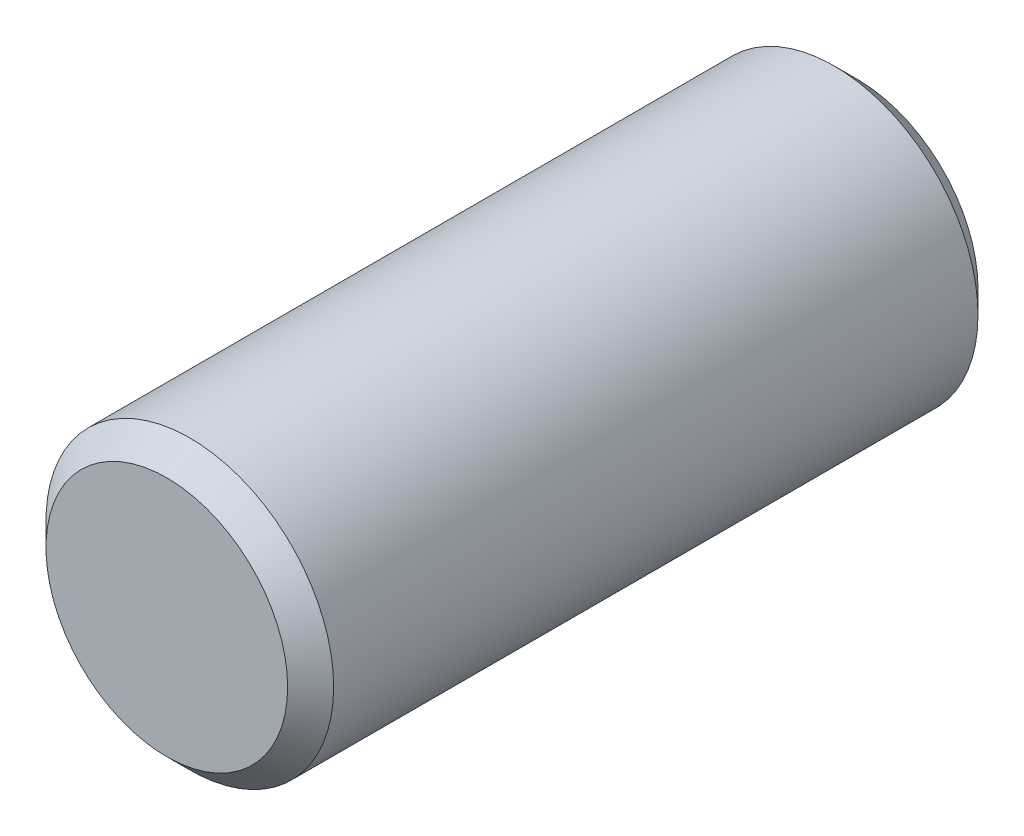
from build123d import *

# Parameters (mm, degrees)
SKETCH_1_R      = 1.25
EXTRUDE_1_DEPTH = 6
CHAMFER_1_SIZE  = 0.2


with BuildPart() as part:
    # 草图1 → 凸台-拉伸1 (new body)
    with BuildSketch(Plane.XY):
        Circle(SKETCH_1_R)
    extrude(amount=EXTRUDE_1_DEPTH)

    # 倒角1
    chamfer_1_edges = [part.edges().sort_by_distance(p)[0] for p in [
        (-1.25, 0, 0),
        (-1.25, 0, 6),
    ]]
    chamfer(chamfer_1_edges, length=CHAMFER_1_SIZE)


solid = part.part
